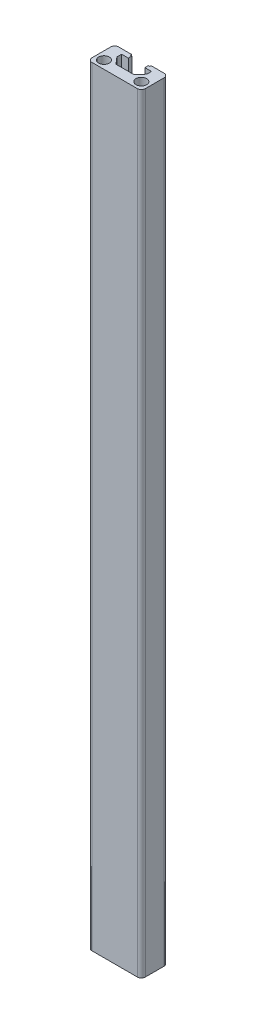
from build123d import *

# Parameters (mm, degrees)
SKETCH_1_R      = 2
EXTRUDE_1_DEPTH = 288
FILLET_1_R      = 1.5


with BuildPart() as part:
    # 草图1 → 凸台-拉伸1 (new body)
    with BuildSketch(Plane(origin=(0, 0, 0), x_dir=(1, 0, 0), z_dir=(0, 1, 0))):
        Polygon((0, 0), (20, 0), (20, 10), (13.65, 10), (13.65, 9.510427602), (13.1, 9.510427602), (13.1, 8.2), (15.6, 8.2), (15.6, 6.447507136), (13.412706863, 3.9), (6.587293137, 3.9), (4.4, 6.447507136), (4.4, 8.2), (6.9, 8.2), (6.9, 9.510427602), (6.35, 9.510427602), (6.35, 10), (0, 10), align=None)
        with Locations(Location((3, 3, 0), (0, 0, 270))):
            Circle(SKETCH_1_R, mode=Mode.SUBTRACT)
        with Locations(Location((17, 3, 0), (0, 0, 270))):
            Circle(SKETCH_1_R, mode=Mode.SUBTRACT)
    extrude(amount=EXTRUDE_1_DEPTH)

    # 圆角1
    fillet_1_edges = [part.edges().sort_by_distance(p)[0] for p in [
        (0, 144, -10),
        (20, 144, -10),
        (20, 144, 0),
        (0, 144, 0),
    ]]
    fillet(fillet_1_edges, radius=FILLET_1_R)


solid = part.part
